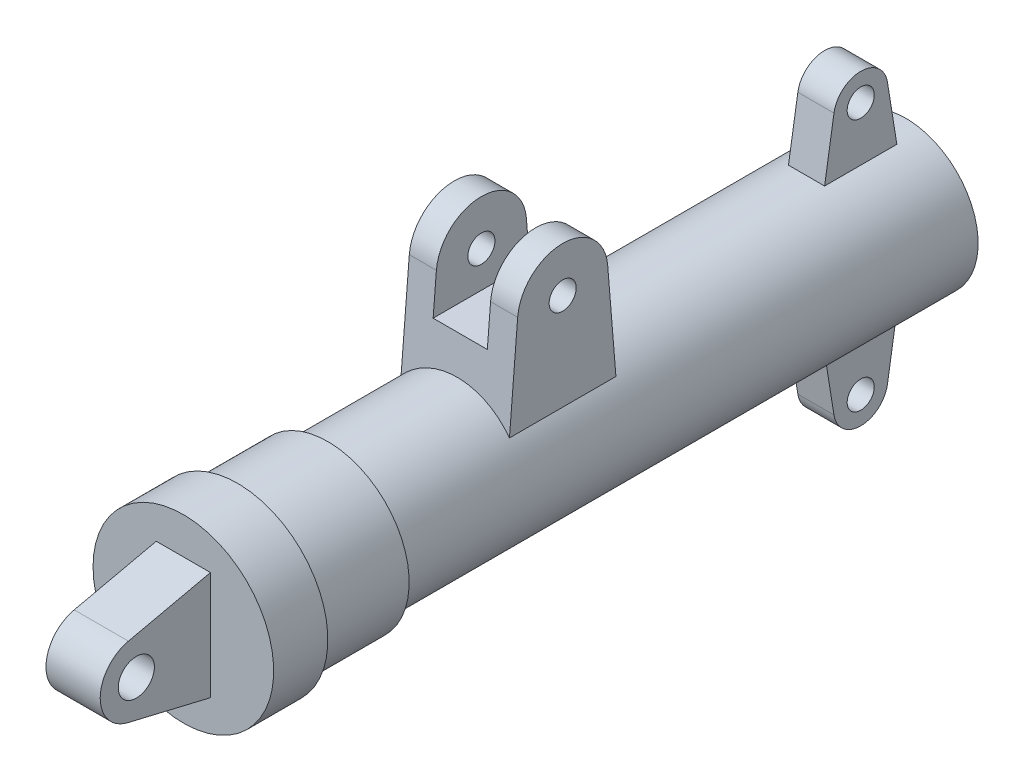
from build123d import *

# Parameters (mm, degrees)
SKETCH3_R           = 10
BOSS_EXTRUDE1_DEPTH = 15
SKETCH4_R           = 7.5
BOSS_EXTRUDE3_DEPTH = 10
SKETCH6_R           = 7.5
BOSS_EXTRUDE4_DEPTH = 30
SKETCH7_W           = 70
SKETCH7_H           = 80
CUT_EXTRUDE5_DEPTH  = 15


with BuildPart() as part:
    # Sketch1 → Revolve1 (revolve)
    with BuildSketch(Plane.YZ, mode=Mode.PRIVATE) as revolve1_sk:
        Polygon((0, 336.940298507), (0, 351.940298507), (50, 351.940298507), (50, 321.940298507), (45, 321.940298507), (45, 271.940298507), (40, 271.940298507), (40, -48.059701493), (22.5, -48.059701493), (22.5, -43.059701493), (35, -43.059701493), (35, 336.940298507), align=None)
    revolve(revolve1_sk.sketch.rotate(Axis((0, 0, 336.940298507), (0, 0, 1)), 90), axis=Axis((0, 0, 336.940298507), (0, 0, 1)))

    # Sketch3 → Boss-Extrude1 (add, symmetric)
    with BuildSketch(Plane.YZ):
        with BuildLine():
            Line((29.697185321, 351.940298507), (-30.302814679, 351.940298507))
            Line((-30.302814679, 351.940298507), (-19.458836039, 397.603771946))
            ThreePointArc((-19.458836039, 397.603771946), (0.126257133, 412.982367034), (19.515627425, 397.357726842))
            Line((19.515627425, 397.357726842), (29.697185321, 351.940298507))
        make_face()
        with Locations(Location((0, 392.98276556, 0), (0, 0, 270))):
            Circle(SKETCH3_R, mode=Mode.SUBTRACT)
    extrude(amount=BOSS_EXTRUDE1_DEPTH, both=True)

    # Sketch6 → Boss-Extrude4 (add, symmetric)
    with BuildSketch(Plane.YZ):
        with BuildLine():
            Line((20, 141.940298507), (20, 201.940298507))
            Line((20, 201.940298507), (82.041582998, 196.856797837))
            ThreePointArc((82.041582998, 196.856797837), (105, 171.940298507), (82.041582998, 147.023799177))
            Line((82.041582998, 147.023799177), (20, 141.940298507))
        make_face()
        with Locations(Location((80, 171.940298507, 0), (0, 0, 270))):
            Circle(SKETCH6_R, mode=Mode.SUBTRACT)
    extrude(amount=BOSS_EXTRUDE4_DEPTH, both=True)

    # Sketch7 → Cut-Extrude5 (cut, symmetric)
    with BuildSketch(Plane.YZ):
        with Locations((95, 171.940298507)):
            Rectangle(SKETCH7_W, SKETCH7_H)
    extrude(amount=CUT_EXTRUDE5_DEPTH, both=True, mode=Mode.SUBTRACT)


with BuildPart() as body_2:
    # Sketch4 → Boss-Extrude3 (new, symmetric)
    with BuildSketch(Plane.YZ):
        with BuildLine():
            Line((40, 6.940298507), (72.373967528, 1.7512498))
            ThreePointArc((72.373967528, 1.7512498), (85, -13.059701493), (72.373967528, -27.870652785))
            Line((72.373967528, -27.870652785), (40, -33.059701493))
            Line((40, -33.059701493), (40, 6.940298507))
        make_face()
        with Locations(Location((70, -13.059701493, 0), (0, 0, 270))):
            Circle(SKETCH4_R, mode=Mode.SUBTRACT)
    extrude(amount=BOSS_EXTRUDE3_DEPTH, both=True)


with BuildPart() as body_3:
    # Mirror3: mirrored copy
    add(body_2.part.mirror(Plane.ZX))


solid = Compound([part.part, body_2.part, body_3.part])
